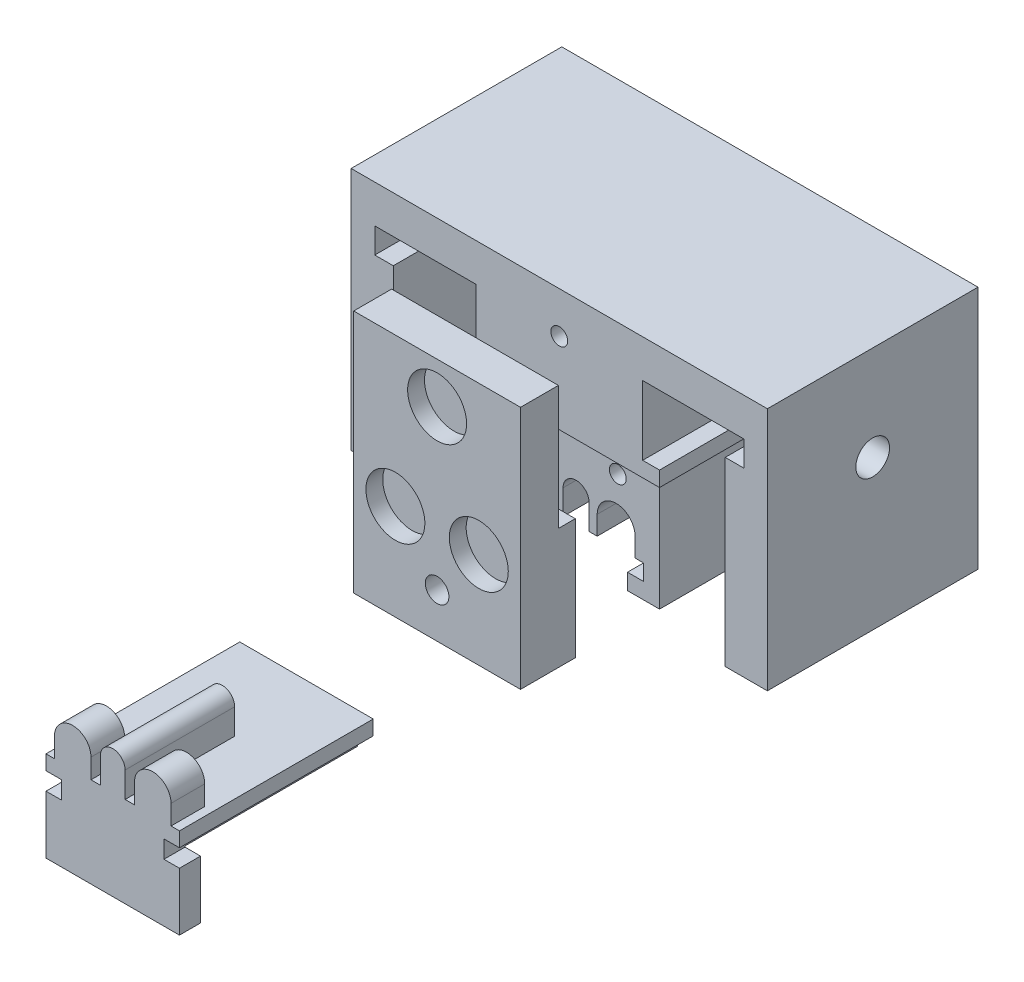
from build123d import *

# Parameters (mm, degrees)
BOSS_EXTRUDE1_DEPTH     = 25
SKETCH2_R               = 2
CUT_EXTRUDE1_DEPTH      = 58.232945058
CUT_EXTRUDE2_DEPTH      = 6
CUT_EXTRUDE2_DEPTH_BACK = 6
SKETCH6_W               = 6
SKETCH6_H               = 7.1
CUT_EXTRUDE3_DEPTH      = 10.450407
CUT_EXTRUDE4_REACH      = 40.018
CUT_EXTRUDE5_DEPTH      = 23
SKETCH12_W              = 19.8
SKETCH12_H              = 14.5
CUT_EXTRUDE6_DEPTH      = 2
CUT_EXTRUDE7_DEPTH      = 2
CUT_EXTRUDE7_DEPTH_BACK = 12
SKETCH13_R              = 1
SKETCH14_W              = 19.8
SKETCH14_H              = 29
SKETCH14_R              = 1.25
BOSS_EXTRUDE2_DEPTH     = 4.5
SKETCH15_W              = 19.8
SKETCH15_H              = 14.3
SKETCH15_R              = 1.25
BOSS_EXTRUDE3_DEPTH     = 2
SKETCH16_R              = 3.5
CUT_EXTRUDE8_DEPTH      = 2
SKETCH17_R              = 1.25
BOSS_EXTRUDE4_DEPTH     = 0.6
CUT_EXTRUDE9_DEPTH      = 2.6
SKETCH19_R              = 1.4
CUT_EXTRUDE10_DEPTH     = 3.9
BOSS_EXTRUDE5_DEPTH     = 23
SKETCH21_W              = 12.16
SKETCH21_H              = 2.5
BOSS_EXTRUDE6_DEPTH     = 7
CUT_EXTRUDE11_DEPTH     = 10
CUT_EXTRUDE12_DEPTH     = 9
SKETCH25_W              = 1.84
SKETCH25_H              = 6.88
BOSS_EXTRUDE7_DEPTH     = 2.5


with BuildPart() as part:
    # Sketch1 → Boss-Extrude1 (new body)
    with BuildSketch(Plane.XY):
        Polygon((-21.9, 7), (-21.9, 10), (-9.9, 10), (-9.9, 1.8), (-11.9, 1.8), (-11.9, 0), (-9.9, 0), (-9.9, -14.5), (9.9, -14.5), (9.9, 0), (11.9, 0), (11.9, 1.8), (9.9, 1.8), (9.9, 10), (21.9, 10), (21.9, 7), (19.7, 7), (19.7, -14.5), (24.7, -14.5), (24.7, 14.5), (-24.7, 14.5), (-24.7, -14.5), (-19.7, -14.5), (-19.7, 7), align=None)
    extrude(amount=BOSS_EXTRUDE1_DEPTH)

    # Sketch2 → Cut-Extrude1 (cut, through all)
    with BuildSketch(Plane.ZY.offset(24.7)):
        with Locations((12.5, 3.25)):
            Circle(SKETCH2_R)
    extrude(amount=-CUT_EXTRUDE1_DEPTH, mode=Mode.SUBTRACT)

    # Sketch5 → Cut-Extrude2 (cut, two sides: drawn at the far end of the back side and taken through both)
    with BuildSketch(Plane(origin=(0, 0, 0), x_dir=(0, 0, -1), z_dir=(1, 0, 0)).offset(-CUT_EXTRUDE2_DEPTH_BACK)):
        Polygon((-8.400813089, 3.25), (-10.450406544, 6.8), (-14.549593456, 6.8), (-16.599186911, 3.25), (-14.549593456, -0.3), (-10.450406544, -0.3), align=None)
    extrude(amount=CUT_EXTRUDE2_DEPTH + CUT_EXTRUDE2_DEPTH_BACK, mode=Mode.SUBTRACT)

    # Sketch6 → Cut-Extrude3 (cut)
    with BuildSketch(Plane.XY):
        with Locations((0, 3.25)):
            Rectangle(SKETCH6_W, SKETCH6_H)
    extrude(amount=CUT_EXTRUDE3_DEPTH, mode=Mode.SUBTRACT)

    # Sketch9 → Cut-Extrude4 (cut, up to next)
    with BuildSketch(Plane.XY.offset(25), mode=Mode.PRIVATE) as cut_extrude4_sk1:
        Polygon((-6.1, -14.5), (6.1, -14.5), (6.1, -12.6), (8, -12.6), (8, -10.7), (-8, -10.7), (-8, -12.6), (-6.1, -12.6), align=None)
    cut_extrude4_tool1 = extrude(cut_extrude4_sk1.sketch, amount=-CUT_EXTRUDE4_REACH, mode=Mode.PRIVATE) & part.part
    add(cut_extrude4_tool1.solids().sort_by_distance((0, -12.471986, 25))[0], mode=Mode.SUBTRACT)

    # Sketch11 → Cut-Extrude5 (cut)
    with BuildSketch(Plane.XY.offset(25)):
        with BuildLine():
            Line((-7, -8.45), (-7, -10.7))
            Line((-7, -10.7), (-2.5, -10.7))
            Line((-2.5, -10.7), (-2.5, -8.45))
            ThreePointArc((-2.5, -8.45), (-4.75, -6.2), (-7, -8.45))
        make_face()
        with BuildLine():
            Line((2.5, -8.45), (2.5, -10.7))
            Line((2.5, -10.7), (7, -10.7))
            Line((7, -10.7), (7, -8.45))
            ThreePointArc((7, -8.45), (4.75, -6.2), (2.5, -8.45))
        make_face()
        with BuildLine():
            Line((-1.55, -7.75), (-1.55, -10.7))
            Line((-1.55, -10.7), (1.55, -10.7))
            Line((1.55, -10.7), (1.55, -7.75))
            ThreePointArc((1.55, -7.75), (0, -6.2), (-1.55, -7.75))
        make_face()
    extrude(amount=-CUT_EXTRUDE5_DEPTH, mode=Mode.SUBTRACT)

    # Sketch12 → Cut-Extrude6 (cut)
    with BuildSketch(Plane.XY.offset(25)):
        with Locations((0, -7.25)):
            Rectangle(SKETCH12_W, SKETCH12_H)
    extrude(amount=-CUT_EXTRUDE6_DEPTH, mode=Mode.SUBTRACT)

    # Sketch13 → Cut-Extrude7 (cut, two sides: drawn at the far end of the back side and taken through both)
    with BuildSketch(Plane.XY.offset(23).offset(-CUT_EXTRUDE7_DEPTH_BACK)):
        with Locations((-4.95, -3.1)):
            Circle(SKETCH13_R)
        with Locations((4.95, -3.1)):
            Circle(SKETCH13_R)
        with Locations((0, 9.6)):
            Circle(SKETCH13_R)
    extrude(amount=CUT_EXTRUDE7_DEPTH + CUT_EXTRUDE7_DEPTH_BACK, mode=Mode.SUBTRACT)


with BuildPart() as body_2:
    # Sketch14 → Boss-Extrude2 (new body)
    with BuildSketch(Plane.XY.offset(35)):
        Rectangle(SKETCH14_W, SKETCH14_H)
        with Locations((0, 9.6)):
            Circle(SKETCH14_R, mode=Mode.SUBTRACT)
        with Locations((-4.95, -3.1)):
            Circle(SKETCH14_R, mode=Mode.SUBTRACT)
        with Locations((4.95, -3.1)):
            Circle(SKETCH14_R, mode=Mode.SUBTRACT)
    extrude(amount=BOSS_EXTRUDE2_DEPTH)

    # Sketch15 → Boss-Extrude3 (add)
    with BuildSketch(Plane(origin=(0, 0, 35), x_dir=(-1, 0, 0), z_dir=(0, 0, -1))):
        with Locations((0, -7.35)):
            Rectangle(SKETCH15_W, SKETCH15_H)
        with Locations((4.95, -3.1)):
            Circle(SKETCH15_R, mode=Mode.SUBTRACT)
        with Locations((-4.95, -3.1)):
            Circle(SKETCH15_R, mode=Mode.SUBTRACT)
    extrude(amount=BOSS_EXTRUDE3_DEPTH)

    # Sketch16 → Cut-Extrude8 (cut)
    with BuildSketch(Plane.XY.offset(39.5)):
        with Locations((4.95, -3.1)):
            Circle(SKETCH16_R)
        with Locations((-4.95, -3.1)):
            Circle(SKETCH16_R)
        with Locations((0, 9.6)):
            Circle(SKETCH16_R)
    extrude(amount=-CUT_EXTRUDE8_DEPTH, mode=Mode.SUBTRACT)

    # Sketch17 → Boss-Extrude4 (add)
    with BuildSketch(Plane.XY.offset(37.5)):
        with Locations((0, 9.6)):
            Circle(SKETCH17_R)
        with Locations(Location((-4.95, -3.1, 0), (0, 0, 180))):
            Circle(SKETCH17_R)
        with Locations(Location((4.95, -3.1, 0), (0, 0, 180))):
            Circle(SKETCH17_R)
    extrude(amount=-BOSS_EXTRUDE4_DEPTH)

    # Sketch18 → Cut-Extrude9 (cut)
    with BuildSketch(Plane(origin=(0, 0, 33), x_dir=(-1, 0, 0), z_dir=(0, 0, -1))):
        Polygon((-3.175426481, -9.225), (-1.58771324, -11.975), (1.58771324, -11.975), (3.175426481, -9.225), (1.58771324, -6.475), (-1.58771324, -6.475), align=None)
    extrude(amount=-CUT_EXTRUDE9_DEPTH, mode=Mode.SUBTRACT)

    # Sketch19 → Cut-Extrude10 (cut)
    with BuildSketch(Plane(origin=(0, 0, 35.6), x_dir=(-1, 0, 0), z_dir=(0, 0, -1))):
        with Locations((0, -9.225)):
            Circle(SKETCH19_R)
    extrude(amount=-CUT_EXTRUDE10_DEPTH, mode=Mode.SUBTRACT)


with BuildPart() as body_3:
    # Sketch20 → Boss-Extrude5 (new body)
    with BuildSketch(Plane.XY.offset(55)):
        with BuildLine():
            Line((-6.08, -12.52), (-7.92, -12.52))
            Line((-7.92, -12.52), (-7.92, -10.78))
            Line((-7.92, -10.78), (-6.92, -10.78))
            Line((-6.92, -10.78), (-6.92, -8.45))
            ThreePointArc((-6.92, -8.45), (-4.75, -6.28), (-2.58, -8.45))
            Line((-2.58, -8.45), (-2.58, -10.78))
            Line((-2.58, -10.78), (-1.47, -10.78))
            Line((-1.47, -10.78), (-1.47, -7.75))
            ThreePointArc((-1.47, -7.75), (0, -6.28), (1.47, -7.75))
            Line((1.47, -7.75), (1.47, -10.78))
            Line((1.47, -10.78), (2.58, -10.78))
            Line((2.58, -10.78), (2.58, -8.45))
            ThreePointArc((2.58, -8.45), (4.75, -6.28), (6.92, -8.45))
            Line((6.92, -8.45), (6.92, -10.78))
            Line((6.92, -10.78), (7.92, -10.78))
            Line((7.92, -10.78), (7.92, -12.52))
            Line((7.92, -12.52), (6.08, -12.52))
            Line((6.08, -12.52), (6.08, -14.5))
            Line((6.08, -14.5), (-6.08, -14.5))
            Line((-6.08, -14.5), (-6.08, -12.52))
        make_face()
    extrude(amount=BOSS_EXTRUDE5_DEPTH)

    # Sketch21 → Boss-Extrude6 (add)
    with BuildSketch(Plane.XZ.offset(14.5)):
        with Locations((0, 76.75)):
            Rectangle(SKETCH21_W, SKETCH21_H)
    extrude(amount=BOSS_EXTRUDE6_DEPTH)

    # Sketch22 → Cut-Extrude11 (cut)
    with BuildSketch(Plane(origin=(0, 0, 55), x_dir=(-1, 0, 0), z_dir=(0, 0, -1))):
        with BuildLine():
            Line((2.58, -10.78), (6.92, -10.78))
            Line((6.92, -10.78), (6.92, -8.45))
            ThreePointArc((6.92, -8.45), (4.75, -6.28), (2.58, -8.45))
            Line((2.58, -8.45), (2.58, -10.78))
        make_face()
        with BuildLine():
            Line((-1.47, -10.78), (1.47, -10.78))
            Line((1.47, -10.78), (1.47, -7.75))
            ThreePointArc((1.47, -7.75), (0, -6.28), (-1.47, -7.75))
            Line((-1.47, -7.75), (-1.47, -10.78))
        make_face()
        with BuildLine():
            Line((-6.92, -10.78), (-2.58, -10.78))
            Line((-2.58, -10.78), (-2.58, -8.45))
            ThreePointArc((-2.58, -8.45), (-4.75, -6.28), (-6.92, -8.45))
            Line((-6.92, -8.45), (-6.92, -10.78))
        make_face()
    extrude(amount=-CUT_EXTRUDE11_DEPTH, mode=Mode.SUBTRACT)

    # Sketch23 → Cut-Extrude12 (cut)
    with BuildSketch(Plane(origin=(0, 0, 65), x_dir=(-1, 0, 0), z_dir=(0, 0, -1))):
        with BuildLine():
            Line((6.92, -10.78), (6.92, -8.45))
            ThreePointArc((6.92, -8.45), (4.75, -6.28), (2.58, -8.45))
            Line((2.58, -8.45), (2.58, -10.78))
            Line((2.58, -10.78), (6.92, -10.78))
        make_face()
        with BuildLine():
            Line((-2.58, -10.78), (-2.58, -8.45))
            ThreePointArc((-2.58, -8.45), (-4.75, -6.28), (-6.92, -8.45))
            Line((-6.92, -8.45), (-6.92, -10.78))
            Line((-6.92, -10.78), (-2.58, -10.78))
        make_face()
    extrude(amount=-CUT_EXTRUDE12_DEPTH, mode=Mode.SUBTRACT)

    # Sketch25 → Boss-Extrude7 (add)
    with BuildSketch(Plane.XY.offset(78)):
        with Locations((-7, -18.06)):
            Rectangle(SKETCH25_W, SKETCH25_H)
        with Locations((7, -18.06)):
            Rectangle(SKETCH25_W, SKETCH25_H)
    extrude(amount=-BOSS_EXTRUDE7_DEPTH)


solid = Compound([part.part, body_2.part, body_3.part])
